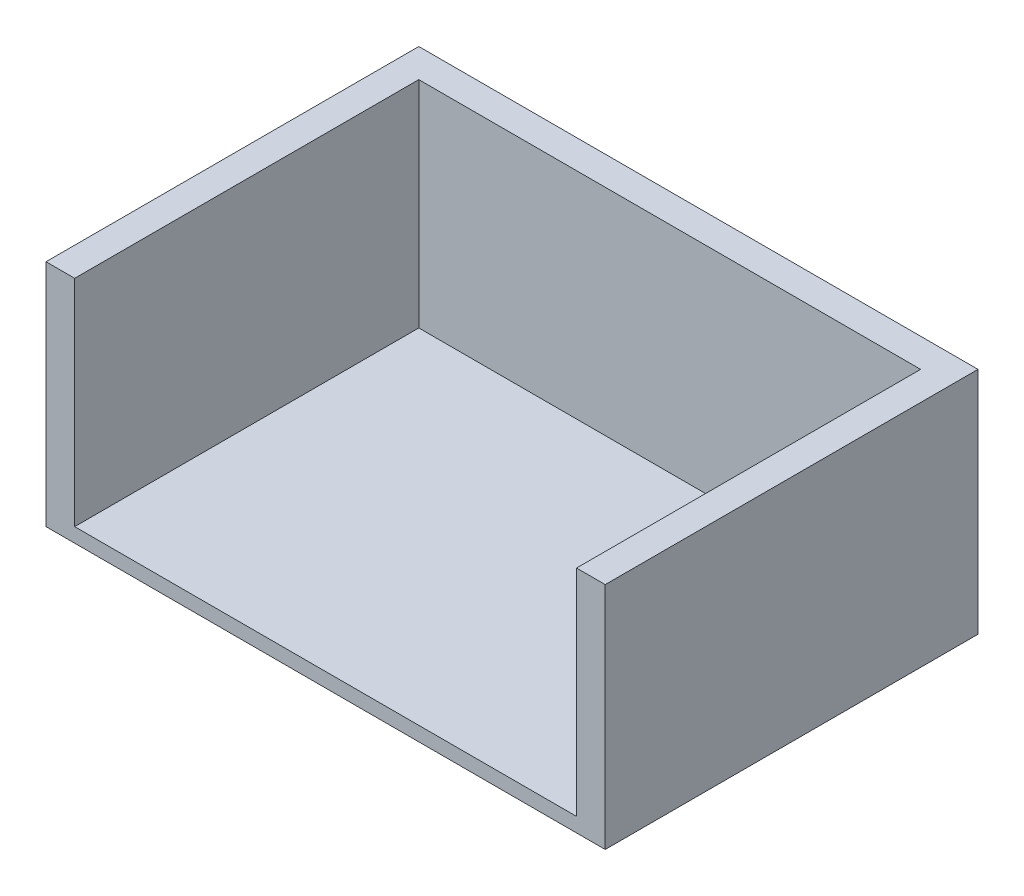
from build123d import *

# Parameters (mm, degrees)
BOSS_EXTRUDE1_DEPTH = 150
SKETCH1_3_W         = 390
SKETCH1_3_H         = 260
BOSS_EXTRUDE2_DEPTH = 10


with BuildPart() as part:
    # Sketch1 → Boss-Extrude1 (new body)
    with BuildSketch(Plane(origin=(0, 0, 0), x_dir=(1, 0, 0), z_dir=(0, 1, 0))):
        Polygon((195, 140), (-195, 140), (-195, -120), (-175, -120), (-175, 120), (175, 120), (175, -120), (195, -120), align=None)
    extrude(amount=BOSS_EXTRUDE1_DEPTH)

    # Sketch1<3> → Boss-Extrude2 (add)
    with BuildSketch(Plane(origin=(0, 0, 0), x_dir=(1, 0, 0), z_dir=(0, 1, 0))):
        with Locations((0, 10)):
            Rectangle(SKETCH1_3_W, SKETCH1_3_H)
    extrude(amount=-BOSS_EXTRUDE2_DEPTH)


solid = part.part
